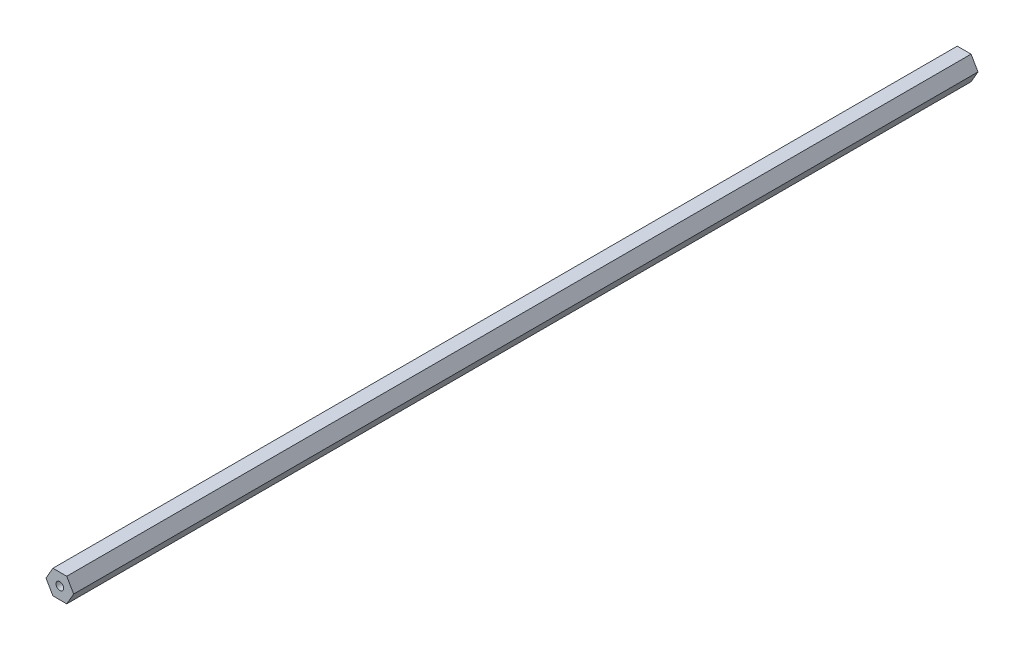
from build123d import *

# Parameters (mm, degrees)
SKETCH1_R           = 2.0193
BOSS_EXTRUDE1_DEPTH = 479.425


with BuildPart() as part:
    # Sketch1 → Boss-Extrude1 (new body)
    with BuildSketch(Plane.XY):
        Polygon((7.332348419, 0), (3.666174209, 6.35), (-3.666174209, 6.35), (-7.332348419, 0), (-3.666174209, -6.35), (3.666174209, -6.35), align=None)
        Circle(SKETCH1_R, mode=Mode.SUBTRACT)
    extrude(amount=BOSS_EXTRUDE1_DEPTH)


solid = part.part
